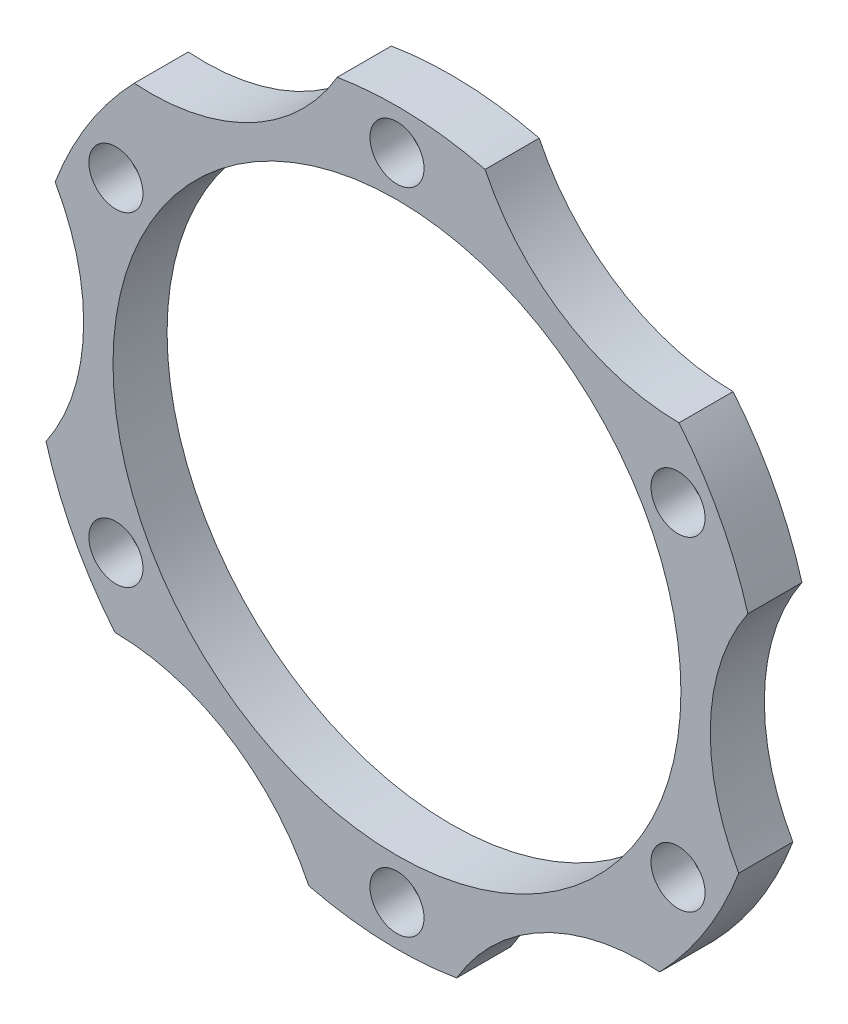
from build123d import *

# Parameters (mm, degrees)
IZIM1_R                     = 67.5
IZIM1_R_2                   = 52.5
IZIM1_R_3                   = 2.75
Y_KSEKLIK_EKSTR_ZYON1_DEPTH = 10
KES_EKSTR_ZYON1_DEPTH       = 14
IZIM3_R                     = 5
KES_EKSTR_ZYON2_DEPTH       = 7


with BuildPart() as part:
    # Çizim1 → Yükseklik-Ekstrüzyon1 (new body)
    with BuildSketch(Plane.XY):
        Circle(IZIM1_R)
        Circle(IZIM1_R_2, mode=Mode.SUBTRACT)
        with Locations((0, 60)):
            Circle(IZIM1_R_3, mode=Mode.SUBTRACT)
        with Locations((51.961524227, 30)):
            Circle(IZIM1_R_3, mode=Mode.SUBTRACT)
        with Locations((51.961524227, -30)):
            Circle(IZIM1_R_3, mode=Mode.SUBTRACT)
        with Locations((0, -60)):
            Circle(IZIM1_R_3, mode=Mode.SUBTRACT)
        with Locations((-51.961524227, -30)):
            Circle(IZIM1_R_3, mode=Mode.SUBTRACT)
        with Locations((-51.961524227, 30)):
            Circle(IZIM1_R_3, mode=Mode.SUBTRACT)
    extrude(amount=Y_KSEKLIK_EKSTR_ZYON1_DEPTH)

    # Çizim2 → Kes-Ekstrüzyon1 (cut)
    with BuildSketch(Plane(origin=(0, 0, 0), x_dir=(-1, 0, 0), z_dir=(0, 0, -1))):
        with BuildLine():
            Line((-61.212117231, 43.852600407), (-15, 68.50053352))
            ThreePointArc((-15, 68.50053352), (-33.51113221, 47.561593986), (-61.212117231, 43.852600407))
        make_face()
        with BuildLine():
            Line((7.371407359, 74.937548745), (51.823202201, 47.240647817))
            ThreePointArc((51.823202201, 47.240647817), (24.433982531, 52.802288797), (7.371407359, 74.937548745))
        make_face()
        with BuildLine():
            Line((68.58352459, 31.084948338), (66.823202201, -21.259885703))
            ThreePointArc((66.823202201, -21.259885703), (57.945114741, 5.240694811), (68.58352459, 31.084948338))
        make_face()
        with BuildLine():
            Line((61.212117231, -43.852600407), (15, -68.50053352))
            ThreePointArc((15, -68.50053352), (33.51113221, -47.561593986), (61.212117231, -43.852600407))
        make_face()
        with BuildLine():
            Line((-7.371407359, -74.937548745), (-51.823202201, -47.240647817))
            ThreePointArc((-51.823202201, -47.240647817), (-24.433982531, -52.802288797), (-7.371407359, -74.937548745))
        make_face()
        with BuildLine():
            Line((-68.58352459, -31.084948338), (-66.823202201, 21.259885703))
            ThreePointArc((-66.823202201, 21.259885703), (-57.945114741, -5.240694811), (-68.58352459, -31.084948338))
        make_face()
    extrude(amount=-KES_EKSTR_ZYON1_DEPTH, mode=Mode.SUBTRACT)

    # Çizim3 → Kes-Ekstrüzyon2 (cut)
    with BuildSketch(Plane.XY.offset(10)):
        with Locations((0, 60)):
            Circle(IZIM3_R)
        with Locations((51.961524227, 30)):
            Circle(IZIM3_R)
        with Locations((51.961524227, -30)):
            Circle(IZIM3_R)
        with Locations((0, -60)):
            Circle(IZIM3_R)
        with Locations((-51.961524227, -30)):
            Circle(IZIM3_R)
        with Locations((-51.961524227, 30)):
            Circle(IZIM3_R)
    extrude(amount=-KES_EKSTR_ZYON2_DEPTH, mode=Mode.SUBTRACT)


solid = part.part
